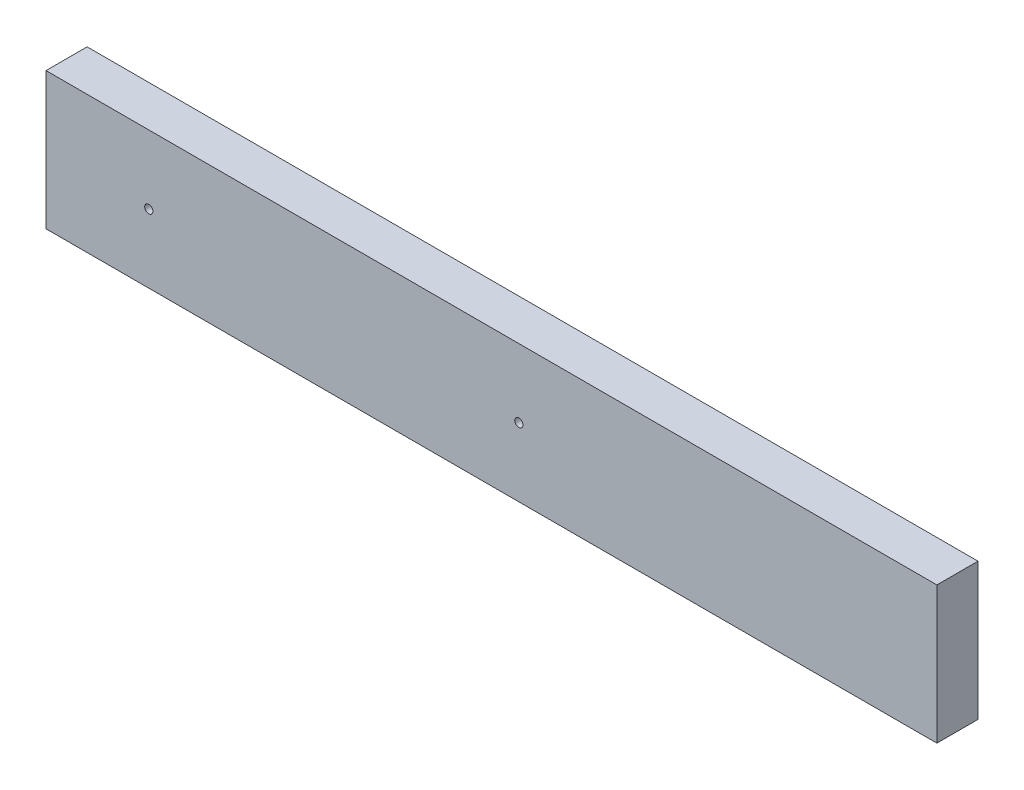
from build123d import *

# Parameters (mm, degrees)
SKETCH1_W           = 650
SKETCH1_H           = 100
BOSS_EXTRUDE1_DEPTH = 30
SKETCH2_R           = 3
CUT_EXTRUDE1_DEPTH  = 331.189339622


with BuildPart() as part:
    # Sketch1 → Boss-Extrude1 (new body)
    with BuildSketch(Plane.XY):
        Rectangle(SKETCH1_W, SKETCH1_H)
    extrude(amount=BOSS_EXTRUDE1_DEPTH)

    # Sketch2 → Cut-Extrude1 (cut, through all)
    with BuildSketch(Plane.XY):
        with Locations((20, 0)):
            Circle(SKETCH2_R)
        with Locations((-250, 0)):
            Circle(SKETCH2_R)
    extrude(amount=CUT_EXTRUDE1_DEPTH, mode=Mode.SUBTRACT)


solid = part.part
